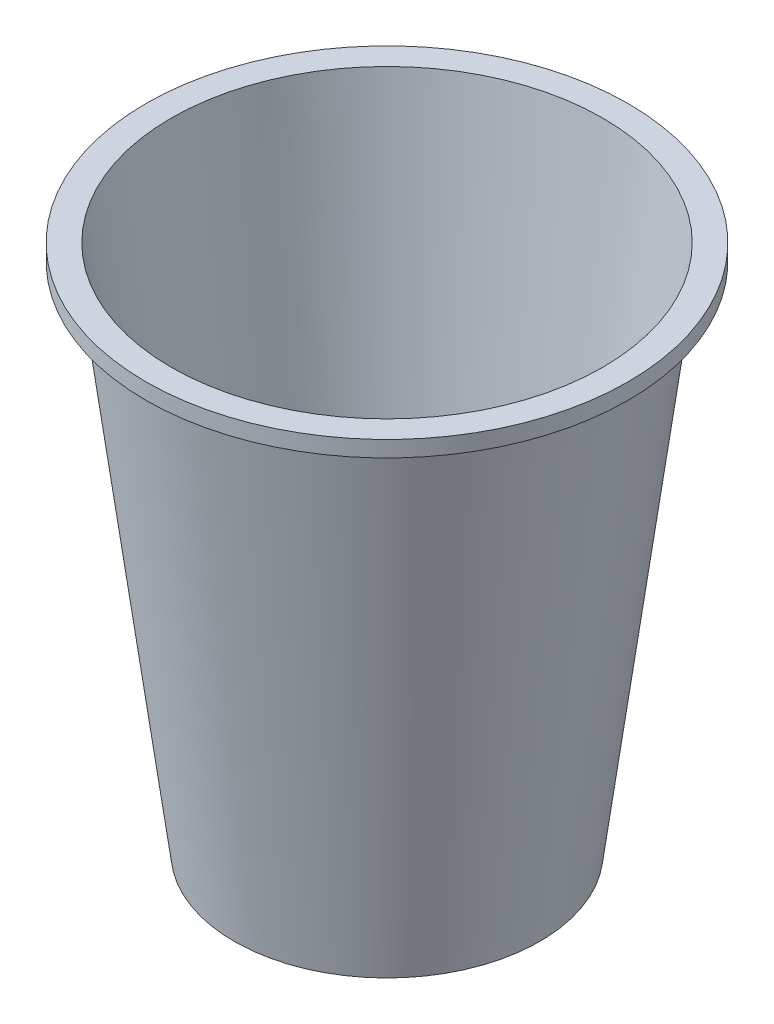
from build123d import *

# Parameters (mm, degrees)
COQUE1_T           = -1
ESQUISSE2_R        = 49.69
ESQUISSE2_R_2      = 44.491785277
BOSS_EXTRU_1_DEPTH = 3.3


with BuildPart() as part:
    # Esquisse1 → Révolution1 (revolve)
    with BuildSketch(Plane.XY, mode=Mode.PRIVATE) as r_volution1_sk:
        Polygon((0, 0), (31.5, 0), (45.5, 109), (0, 109), align=None)
    revolve(r_volution1_sk.sketch.rotate(Axis((0, 109, 0), (0, -1, 0)), 180), axis=Axis((0, 109, 0), (0, -1, 0)))

    # Coque1
    coque1_openings = [part.faces().sort_by_distance(p)[0] for p in [
        (0, 109, 0),
    ]]
    offset(amount=COQUE1_T, openings=coque1_openings, kind=Kind.INTERSECTION)

    # Esquisse2 → Boss.-Extru.1 (add)
    with BuildSketch(Plane(origin=(0, 109, 0), x_dir=(1, 0, 0), z_dir=(0, 1, 0))):
        with Locations(Location((0, 0, 0), (0, 0, 180))):
            Circle(ESQUISSE2_R)
        Circle(ESQUISSE2_R_2, mode=Mode.SUBTRACT)
    extrude(amount=-BOSS_EXTRU_1_DEPTH)


solid = part.part
